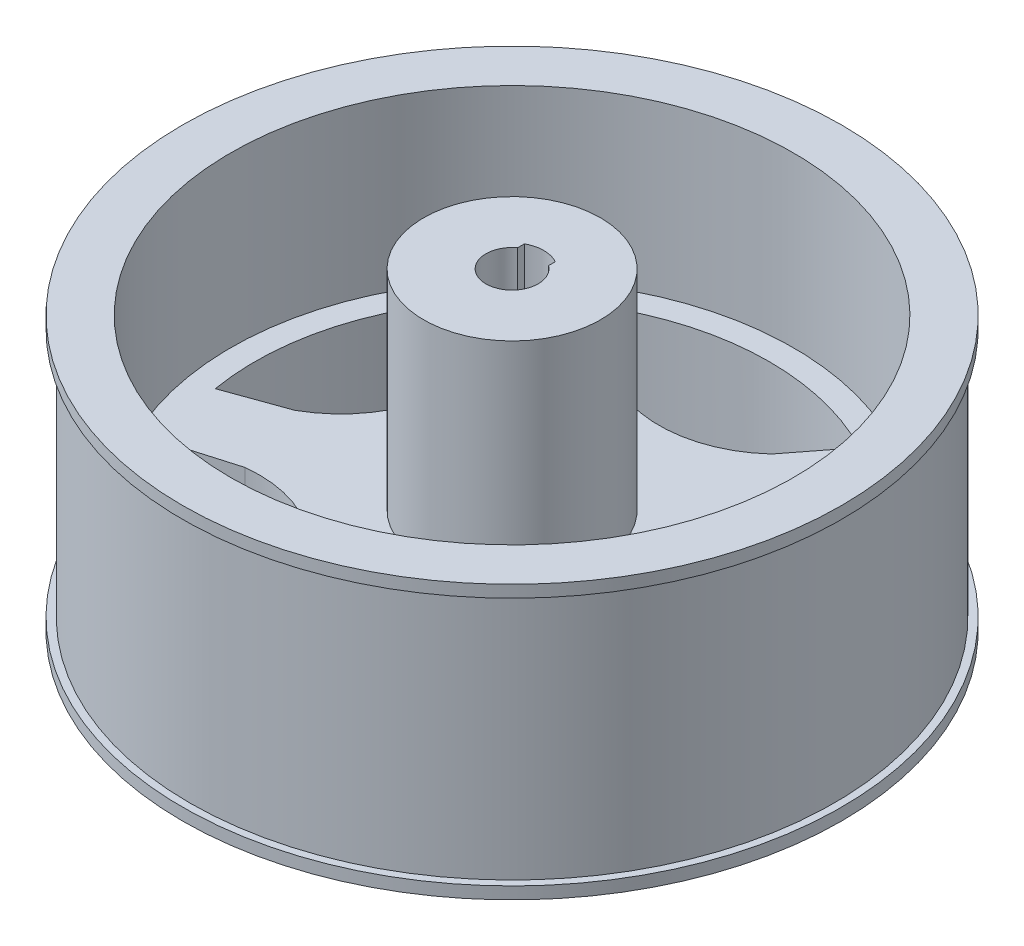
from build123d import *

# Parameters (mm, degrees)
SKETCH1_R             = 41
BOSS_EXTRUDE1_DEPTH   = 34
SKETCH2_R             = 35
CUT_EXTRUDE1_DEPTH    = 21
CUT_EXTRUDE2_DEPTH    = 21
SKETCH6_R             = 11
BOSS_EXTRUDE2_DEPTH   = 26
ESBO_O1_R             = 3.25
CORTE_EXTRUS_O1_DEPTH = 15
ESBO_O2_W             = 0.9
ESBO_O2_H             = 31
CORTE_EXTRUS_O4_DEPTH = 12.8


with BuildPart() as part:
    # Sketch1 → Boss-Extrude1 (new body)
    with BuildSketch(Plane(origin=(0, 0, 0), x_dir=(1, 0, 0), z_dir=(0, 1, 0))):
        with Locations(Location((0, 0, 0), (0, 0, 270))):
            Circle(SKETCH1_R)
    extrude(amount=BOSS_EXTRUDE1_DEPTH)

    # Sketch2 → Cut-Extrude1 (cut)
    with BuildSketch(Plane(origin=(0, 34, 0), x_dir=(1, 0, 0), z_dir=(0, 1, 0))):
        with Locations(Location((0, 0, 0), (0, 0, 270))):
            Circle(SKETCH2_R)
    extrude(amount=-CUT_EXTRUDE1_DEPTH, mode=Mode.SUBTRACT)

    # Sketch3 → Cut-Extrude2 (cut)
    with BuildSketch(Plane.XZ):
        with BuildLine():
            Line((-4.632760116, 31.662873112), (-4.875607394, 23.89373544))
            ThreePointArc((-4.875607394, 23.89373544), (-10.738660694, 14.77258834), (-21.225170188, 12.015082756))
            Line((-21.225170188, 12.015082756), (-28.681580191, 14.190382579))
            ThreePointArc((-28.681580191, 14.190382579), (-18.809128073, 25.88854382), (-4.632760116, 31.662873112))
        make_face()
        with BuildLine():
            Line((28.681580191, 14.190382579), (21.217647246, 12.020548493))
            ThreePointArc((21.217647246, 12.020548493), (10.731137752, 14.778054077), (4.868084452, 23.899201177))
            Line((4.868084452, 23.899201177), (4.632760116, 31.662873112))
            ThreePointArc((4.632760116, 31.662873112), (18.809128073, 25.88854382), (28.681580191, 14.190382579))
        make_face()
        with BuildLine():
            Line((22.358951525, -22.892734365), (17.988834553, -16.464627908))
            ThreePointArc((17.988834553, -16.464627908), (17.370868563, -5.639248633), (24.23381184, 2.755435876))
            Line((24.23381184, 2.755435876), (31.544783405, 5.378349186))
            ThreePointArc((31.544783405, 5.378349186), (30.433808521, -9.88854382), (22.358951525, -22.892734365))
        make_face()
        with BuildLine():
            Line((-14.862988196, -28.338870512), (-10.099936075, -22.196248152))
            ThreePointArc((-10.099936075, -22.196248152), (0.004649434, -18.263301403), (10.109234942, -22.196248152))
            Line((10.109234942, -22.196248152), (14.862988196, -28.338870512))
            ThreePointArc((14.862988196, -28.338870512), (0, -32), (-14.862988196, -28.338870512))
        make_face()
        with BuildLine():
            Line((-31.544783405, 5.378349186), (-24.230938331, 2.746592128))
            ThreePointArc((-24.230938331, 2.746592128), (-17.367995055, -5.648092381), (-17.985961045, -16.473471657))
            Line((-17.985961045, -16.473471657), (-22.358951525, -22.892734365))
            ThreePointArc((-22.358951525, -22.892734365), (-30.433808521, -9.88854382), (-31.544783405, 5.378349186))
        make_face()
    extrude(amount=-CUT_EXTRUDE2_DEPTH, mode=Mode.SUBTRACT)

    # Sketch5 → Cut-Revolve1 (revolve, cut)
    with BuildSketch(Plane.XY, mode=Mode.PRIVATE) as cut_revolve1_sk:
        with BuildLine():
            Line((28, 0), (32, 0))
            Line((32, 0), (32, 4))
            ThreePointArc((32, 4), (30.828427125, 1.171572875), (28, 0))
        make_face()
        Polygon((0, 0), (0, 2.5), (9, 2.5), (9, 4), (12.5, 4), (14, 0), align=None)
    revolve(cut_revolve1_sk.sketch.rotate(Axis((0, 34, 0), (0, -1, 0)), 90), axis=Axis((0, 34, 0), (0, -1, 0)), mode=Mode.SUBTRACT)

    # Sketch6 → Boss-Extrude2 (add)
    with BuildSketch(Plane(origin=(0, 13, 0), x_dir=(1, 0, 0), z_dir=(0, 1, 0))):
        with Locations(Location((0, 0, 0), (0, 0, 90))):
            Circle(SKETCH6_R)
    extrude(amount=BOSS_EXTRUDE2_DEPTH)

    # Esboço1 → Corte-extrusão1 (cut)
    with BuildSketch(Plane(origin=(0, 39, 0), x_dir=(1, 0, 0), z_dir=(0, 1, 0))):
        with Locations(Location((0, 0, 0), (0, 0, 270))):
            Circle(ESBO_O1_R)
    extrude(amount=-CORTE_EXTRUS_O1_DEPTH, mode=Mode.SUBTRACT)

    # Esboço2 → Corte-Revolução1 (revolve, cut)
    with BuildSketch(Plane.XY, mode=Mode.PRIVATE) as corte_revolu_o1_sk:
        with Locations((-40.55, 17)):
            Rectangle(ESBO_O2_W, ESBO_O2_H)
    revolve(corte_revolu_o1_sk.sketch.rotate(Axis((0, -9.512295102, 0), (0, 1, 0)), 270), axis=Axis((0, -9.512295102, 0), (0, 1, 0)), mode=Mode.SUBTRACT)

    # Esboço3 → Corte-extrusão4 (cut)
    with BuildSketch(Plane(origin=(0, 39, 0), x_dir=(1, 0, 0), z_dir=(0, 1, 0))):
        with BuildLine():
            Line((-1.925, 2.618563538), (-1.925, 3.449184686))
            ThreePointArc((-1.925, 3.449184686), (0, 3.95), (1.925, 3.449184686))
            Line((1.925, 3.449184686), (1.925, 2.618563538))
            ThreePointArc((1.925, 2.618563538), (0, 3.25), (-1.925, 2.618563538))
        make_face()
    extrude(amount=-CORTE_EXTRUS_O4_DEPTH, mode=Mode.SUBTRACT)


solid = part.part
